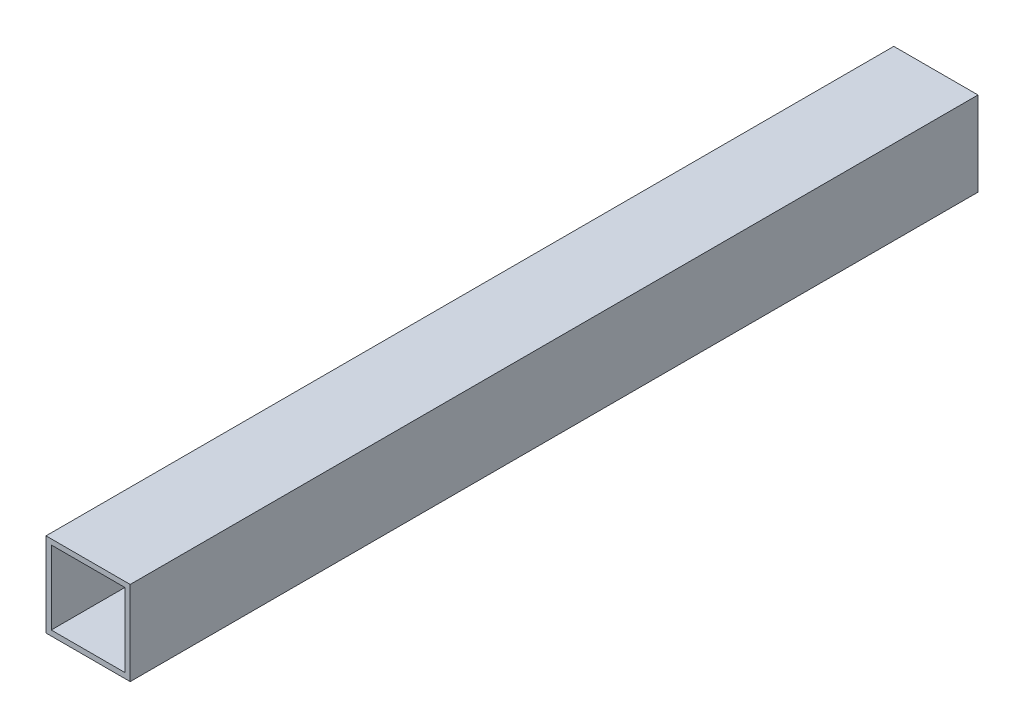
from build123d import *

# Parameters (mm, degrees)
EXTRUDE1_DEPTH      = 236.728
EXTRUDE1_DEPTH_BACK = 19.05
SKETCH1_W           = 25.4
SKETCH1_H           = 25.4
SKETCH1_W_2         = 22.225
SKETCH1_H_2         = 22.225


with BuildPart() as part:
    # Sketch1 → Extrude1 (new, two sides: drawn at the far end of the back side and taken through both)
    with BuildSketch(Plane.XY.offset(-EXTRUDE1_DEPTH_BACK)):
        with Locations((0, -15.875)):
            Rectangle(SKETCH1_W, SKETCH1_H)
        with Locations((0, -15.875)):
            Rectangle(SKETCH1_W_2, SKETCH1_H_2, mode=Mode.SUBTRACT)
    extrude(amount=EXTRUDE1_DEPTH + EXTRUDE1_DEPTH_BACK)


solid = part.part
